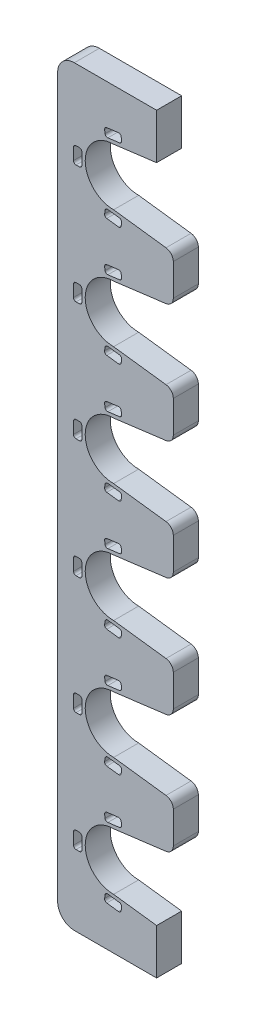
from build123d import *

# Parameters (mm, degrees)
ESQUISSE1_W                  = 47
ESQUISSE1_H                  = 450
BOSS_EXTRU_1_DEPTH           = 15
ENL_V_MAT_EXTRU_1_DEPTH      = 453.696366232
ENL_V_MAT_EXTRU_1_DEPTH_BACK = 453.696366232
ESQUISSE2_R                  = 17
ENL_V_MAT_EXTRU_2_DEPTH      = 453.696366232
ENL_V_MAT_EXTRU_2_DEPTH_BACK = 453.696366232
ESQUISSE4_W                  = 10
ESQUISSE4_H                  = 450
BOSS_EXTRU_2_DEPTH           = 15
ESQUISSE5_W                  = 5
ESQUISSE5_H                  = 10
ENL_V_MAT_EXTRU_3_DEPTH      = 10
CONG_2_R                     = 10
CONG_3_R                     = 1.5
BOSS_EXTRU_3_DEPTH           = 15
CONG_4_R                     = 5


with BuildPart() as part:
    # Esquisse1 → Boss.-Extru.1 (new body)
    with BuildSketch(Plane.XY):
        with Locations((23.5, 225)):
            Rectangle(ESQUISSE1_W, ESQUISSE1_H)
    extrude(amount=BOSS_EXTRU_1_DEPTH)

    # Esquisse2 → Enlèv. mat.-Extru.1 (cut, two sides: drawn at the far end of the back side and taken through both)
    with BuildSketch(Plane.XY.offset(15).offset(-ENL_V_MAT_EXTRU_1_DEPTH_BACK)):
        with Locations((23.5, 260.5)):
            Circle(ESQUISSE2_R)
        with Locations(Location((23.5, 189.5, 0), (0, 0, 180))):
            Circle(ESQUISSE2_R)
        with Locations((23.5, 118.5)):
            Circle(ESQUISSE2_R)
        with Locations(Location((23.5, 47.5, 0), (0, 0, 180))):
            Circle(ESQUISSE2_R)
        with Locations((23.5, 402.5)):
            Circle(ESQUISSE2_R)
        with Locations(Location((23.5, 331.5, 0), (0, 0, 180))):
            Circle(ESQUISSE2_R)
    extrude(amount=ENL_V_MAT_EXTRU_1_DEPTH + ENL_V_MAT_EXTRU_1_DEPTH_BACK, mode=Mode.SUBTRACT)

    # Esquisse3 → Enlèv. mat.-Extru.2 (cut, two sides: drawn at the far end of the back side and taken through both)
    with BuildSketch(Plane.XY.offset(15).offset(-ENL_V_MAT_EXTRU_2_DEPTH_BACK)):
        Polygon((23.5, 243.5), (47, 240.5), (47, 280.5), (23.5, 277.5), align=None)
        Polygon((23.5, 172.5), (47, 169.5), (47, 209.5), (23.5, 206.5), align=None)
        Polygon((23.5, 101.5), (23.5, 135.5), (47, 138.5), (47, 98.5), align=None)
        Polygon((23.5, 30.5), (47, 27.5), (47, 67.5), (23.5, 64.5), align=None)
        Polygon((23.5, 385.5), (23.5, 419.5), (47, 422.5), (47, 382.5), align=None)
        Polygon((23.5, 314.5), (47, 311.5), (47, 351.5), (23.5, 348.5), align=None)
    extrude(amount=ENL_V_MAT_EXTRU_2_DEPTH + ENL_V_MAT_EXTRU_2_DEPTH_BACK, mode=Mode.SUBTRACT)

    # Esquisse4 → Boss.-Extru.2 (add)
    with BuildSketch(Plane.XY.offset(15)):
        with Locations((-5, 225)):
            Rectangle(ESQUISSE4_W, ESQUISSE4_H)
    extrude(amount=-BOSS_EXTRU_2_DEPTH)

    # Esquisse5 → Enlèv. mat.-Extru.3 (cut)
    with BuildSketch(Plane.XY.offset(15)):
        with Locations((2, 189.5)):
            Rectangle(ESQUISSE5_W, ESQUISSE5_H)
        Polygon((18.563980447, 207.886100949), (28.483478243, 209.152419817), (27.850318809, 214.112168715), (17.930821013, 212.845849847), align=None)
        Polygon((27.850318809, 164.887831285), (28.483478243, 169.847580183), (18.563980447, 171.113899051), (17.930821013, 166.154150153), align=None)
        Polygon((18.563980447, 136.886100949), (28.483478243, 138.152419817), (27.850318809, 143.112168715), (17.930821013, 141.845849847), align=None)
        Polygon((27.850318809, 93.887831285), (28.483478243, 98.847580183), (18.563980447, 100.113899051), (17.930821013, 95.154150153), align=None)
        with Locations((2, 118.5)):
            Rectangle(ESQUISSE5_W, ESQUISSE5_H)
        with Locations((2, 47.5)):
            Rectangle(ESQUISSE5_W, ESQUISSE5_H)
        Polygon((18.563980447, 65.886100949), (28.483478243, 67.152419817), (27.850318809, 72.112168715), (17.930821013, 70.845849847), align=None)
        Polygon((27.850318809, 22.887831285), (28.483478243, 27.847580183), (18.563980447, 29.113899051), (17.930821013, 24.154150153), align=None)
        Polygon((18.563980447, 420.886100949), (28.483478243, 422.152419817), (27.850318809, 427.112168715), (17.930821013, 425.845849847), align=None)
        Polygon((27.850318809, 377.887831285), (28.483478243, 382.847580183), (18.563980447, 384.113899051), (17.930821013, 379.154150153), align=None)
        with Locations((2, 402.5)):
            Rectangle(ESQUISSE5_W, ESQUISSE5_H)
        with Locations((2, 331.5)):
            Rectangle(ESQUISSE5_W, ESQUISSE5_H)
        Polygon((18.563980447, 349.886100949), (28.483478243, 351.152419817), (27.850318809, 356.112168715), (17.930821013, 354.845849847), align=None)
        Polygon((27.850318809, 306.887831285), (28.483478243, 311.847580183), (18.563980447, 313.113899051), (17.930821013, 308.154150153), align=None)
        Polygon((18.563980447, 278.886100949), (28.483478243, 280.152419817), (27.850318809, 285.112168715), (17.930821013, 283.845849847), align=None)
        Polygon((27.850318809, 235.887831285), (28.483478243, 240.847580183), (18.563980447, 242.113899051), (17.930821013, 237.154150153), align=None)
        with Locations((2, 260.5)):
            Rectangle(ESQUISSE5_W, ESQUISSE5_H)
    extrude(amount=-ENL_V_MAT_EXTRU_3_DEPTH, mode=Mode.SUBTRACT)

    # Congé2
    cong_2_edges = [part.edges().sort_by_distance(p)[0] for p in [
        (-10, 0, 7.5),
        (-10, 450, 7.5),
    ]]
    fillet(cong_2_edges, radius=CONG_2_R)

    # Congé3
    cong_3_edges = [part.edges().sort_by_distance(p)[0] for p in [
        (-0.5, 184.5, 10),
        (-0.5, 194.5, 10),
        (4.5, 194.5, 10),
        (4.5, 184.5, 10),
        (27.850318809, 22.887831285, 10),
        (17.930821013, 24.154150153, 10),
        (18.563980447, 29.113899051, 10),
        (28.483478243, 27.847580183, 10),
        (-0.5, 42.5, 10),
        (-0.5, 52.5, 10),
        (4.5, 52.5, 10),
        (4.5, 42.5, 10),
        (18.563980447, 65.886100949, 10),
        (17.930821013, 70.845849847, 10),
        (27.850318809, 72.112168715, 10),
        (28.483478243, 67.152419817, 10),
        (4.5, 113.5, 10),
        (-0.5, 113.5, 10),
        (-0.5, 123.5, 10),
        (4.5, 123.5, 10),
        (18.563980447, 136.886100949, 10),
        (17.930821013, 141.845849847, 10),
        (27.850318809, 143.112168715, 10),
        (28.483478243, 138.152419817, 10),
        (18.563980447, 100.113899051, 10),
        (28.483478243, 98.847580183, 10),
        (27.850318809, 93.887831285, 10),
        (17.930821013, 95.154150153, 10),
        (27.850318809, 164.887831285, 10),
        (17.930821013, 166.154150153, 10),
        (18.563980447, 171.113899051, 10),
        (28.483478243, 169.847580183, 10),
        (18.563980447, 207.886100949, 10),
        (17.930821013, 212.845849847, 10),
        (27.850318809, 214.112168715, 10),
        (28.483478243, 209.152419817, 10),
        (4.5, 255.5, 10),
        (-0.5, 255.5, 10),
        (-0.5, 265.5, 10),
        (4.5, 265.5, 10),
        (18.563980447, 278.886100949, 10),
        (17.930821013, 283.845849847, 10),
        (27.850318809, 285.112168715, 10),
        (28.483478243, 280.152419817, 10),
        (27.850318809, 306.887831285, 10),
        (17.930821013, 308.154150153, 10),
        (18.563980447, 313.113899051, 10),
        (28.483478243, 311.847580183, 10),
        (-0.5, 326.5, 10),
        (-0.5, 336.5, 10),
        (4.5, 336.5, 10),
        (4.5, 326.5, 10),
        (4.5, 397.5, 10),
        (-0.5, 397.5, 10),
        (-0.5, 407.5, 10),
        (4.5, 407.5, 10),
        (18.563980447, 384.113899051, 10),
        (28.483478243, 382.847580183, 10),
        (27.850318809, 377.887831285, 10),
        (17.930821013, 379.154150153, 10),
        (18.563980447, 349.886100949, 10),
        (17.930821013, 354.845849847, 10),
        (27.850318809, 356.112168715, 10),
        (28.483478243, 351.152419817, 10),
        (18.563980447, 242.113899051, 10),
        (28.483478243, 240.847580183, 10),
        (27.850318809, 235.887831285, 10),
        (17.930821013, 237.154150153, 10),
        (18.563980447, 420.886100949, 10),
        (17.930821013, 425.845849847, 10),
        (27.850318809, 427.112168715, 10),
        (28.483478243, 422.152419817, 10),
    ]]
    fillet(cong_3_edges, radius=CONG_3_R)

    # Esquisse6 → Boss.-Extru.3 (add)
    with BuildSketch(Plane.XY.offset(15)):
        Polygon((47, 209.5), (59.25, 211.063829787), (59.25, 238.936170213), (47, 240.5), align=None)
        Polygon((47, 138.5), (59.25, 140.063829787), (59.25, 167.936170213), (47, 169.5), align=None)
        Polygon((47, 67.5), (59.25, 69.063829787), (59.25, 96.936170213), (47, 98.5), align=None)
        Polygon((47, 422.5), (49.25, 422.787234043), (49.25, 450), (47, 450), align=None)
        Polygon((47, 280.5), (59.25, 282.063829787), (59.25, 309.936170213), (47, 311.5), align=None)
        Polygon((47, 351.5), (59.25, 353.063829787), (59.25, 380.936170213), (47, 382.5), align=None)
        Polygon((49.25, 0), (47, 0), (47, 27.5), (49.25, 27.212765957), align=None)
    extrude(amount=-BOSS_EXTRU_3_DEPTH)

    # Congé4
    cong_4_edges = [part.edges().sort_by_distance(p)[0] for p in [
        (59.25, 238.936170213, 7.5),
        (59.25, 211.063829787, 7.5),
        (59.25, 167.936170213, 7.5),
        (59.25, 140.063829787, 7.5),
        (59.25, 96.936170213, 7.5),
        (59.25, 69.063829787, 7.5),
        (59.25, 309.936170213, 7.5),
        (59.25, 282.063829787, 7.5),
        (59.25, 380.936170213, 7.5),
        (59.25, 353.063829787, 7.5),
    ]]
    fillet(cong_4_edges, radius=CONG_4_R)


solid = part.part
